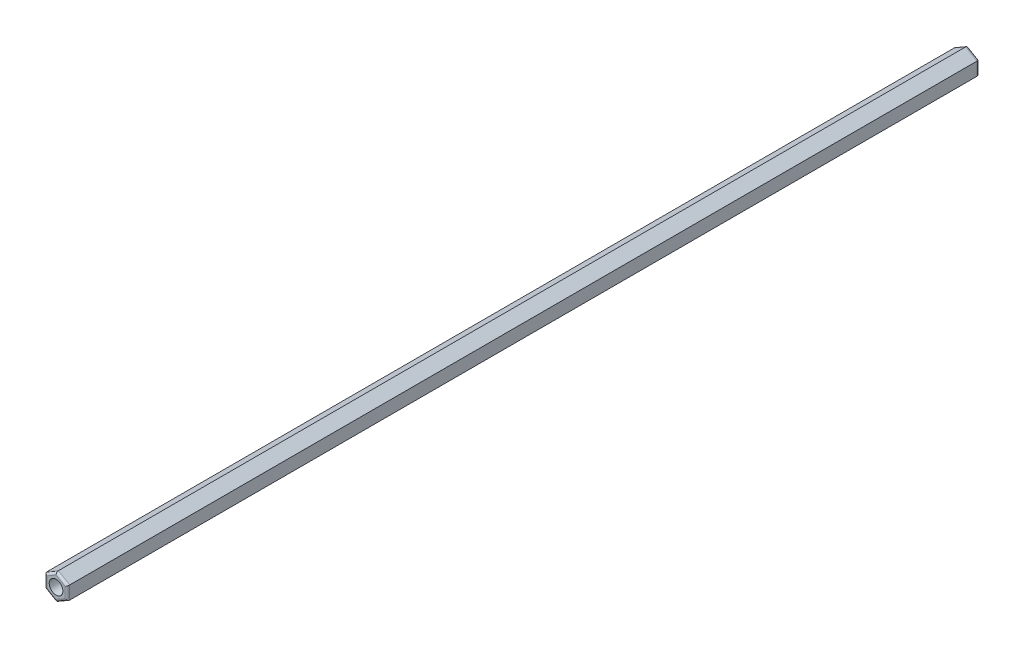
from build123d import *

# Parameters (mm, degrees)
RESSALTO_EXTRUS_O1_DEPTH = 200
FILETE1_R                = 0.5
ESBO_O2_R                = 1.5
CORTE_EXTRUS_O1_DEPTH    = 213.755472611


with BuildPart() as part:
    # Esboço1 → Ressalto-extrusão1 (new body)
    with BuildSketch(Plane(origin=(0, 0, 0), x_dir=(-1, 0, 0), z_dir=(0, 0, -1))):
        Polygon((67.502122675, -1.443375673), (70.002122675, -2.886751346), (72.502122675, -1.443375673), (72.502122675, 1.443375673), (70.002122675, 2.886751346), (67.502122675, 1.443375673), align=None)
    extrude(amount=-RESSALTO_EXTRUS_O1_DEPTH)

    # Filete1
    filete1_edges = [part.edges().sort_by_distance(p)[0] for p in [
        (-71.252122675, -2.165063509, 200),
        (-72.502122675, 0, 200),
        (-71.252122675, 2.165063509, 200),
        (-68.752122675, 2.165063509, 200),
        (-67.502122675, 0, 200),
        (-68.752122675, 2.165063509, 0),
        (-71.252122675, 2.165063509, 0),
        (-72.502122675, 0, 0),
        (-71.252122675, -2.165063509, 0),
        (-68.752122675, -2.165063509, 0),
        (-67.502122675, 0, 0),
        (-68.752122675, -2.165063509, 200),
    ]]
    fillet(filete1_edges, radius=FILETE1_R)

    # Esboço2 → Corte-extrusão1 (cut, through all)
    with BuildSketch(Plane.XY.offset(200)):
        with Locations((-70.002122675, 0)):
            Circle(ESBO_O2_R)
    extrude(amount=-CORTE_EXTRUS_O1_DEPTH, mode=Mode.SUBTRACT)


solid = part.part
